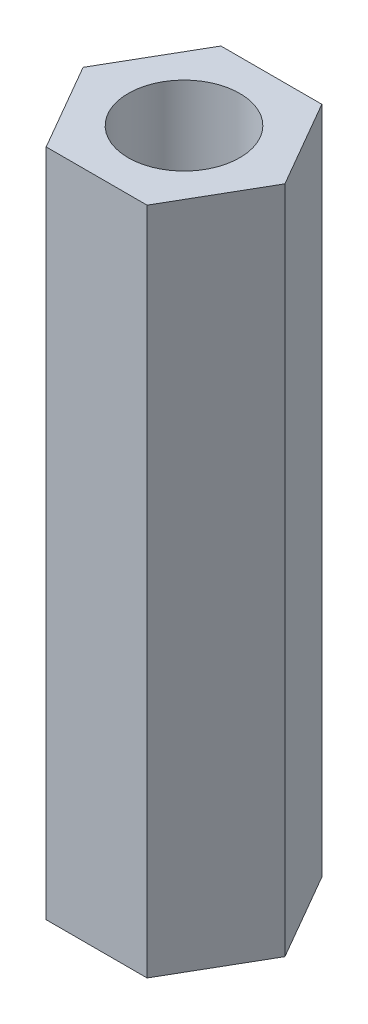
from build123d import *

# Parameters (mm, degrees)
SKETCH_1_R      = 1.5
EXTRUDE_1_DEPTH = 18


with BuildPart() as part:
    # 草图1 → 凸台-拉伸1 (new body)
    with BuildSketch(Plane(origin=(0, 0, 0), x_dir=(1, 0, 0), z_dir=(0, 1, 0))):
        Polygon((1.356773133, -2.35), (2.713546265, 0), (1.356773133, 2.35), (-1.356773133, 2.35), (-2.713546265, 0), (-1.356773133, -2.35), align=None)
        with Locations(Location((0, 0, 0), (0, 0, 270))):
            Circle(SKETCH_1_R, mode=Mode.SUBTRACT)
    extrude(amount=EXTRUDE_1_DEPTH)


solid = part.part
